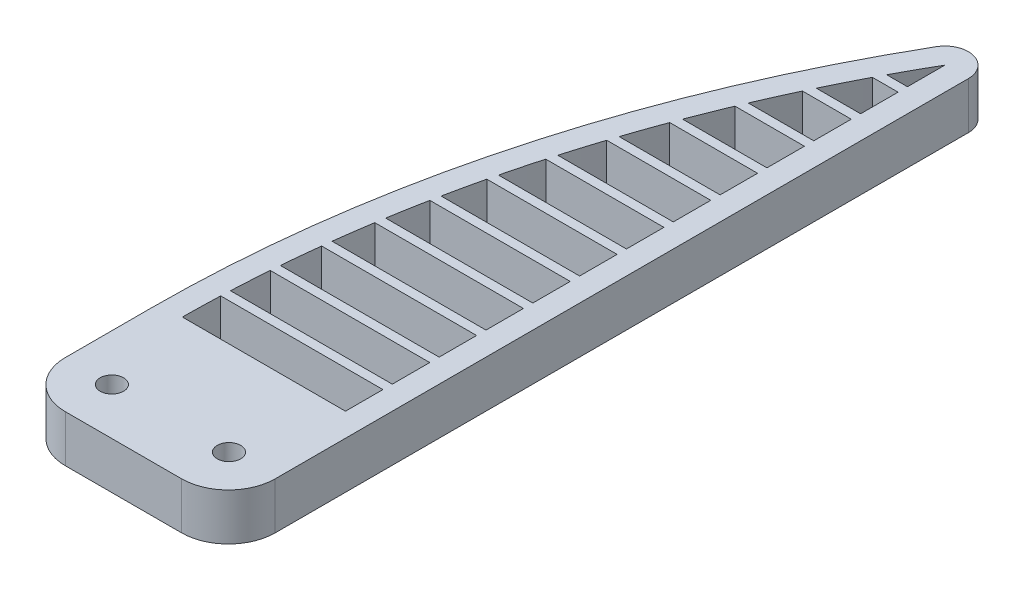
from build123d import *

# Parameters (mm, degrees)
SKETCH1_W           = 34.833395016
SKETCH1_H           = 8
SKETCH1_W_2         = 5
SKETCH1_H_2         = 10
BOSS_EXTRUDE1_DEPTH = 10
FILLET1_R           = 10


with BuildPart() as part:
    # Sketch1 → Boss-Extrude1 (new body)
    with BuildSketch(Plane(origin=(0, 0, 0), x_dir=(1, 0, 0), z_dir=(0, 1, 0))):
        with BuildLine():
            Line((-34.833395016, 0), (0, 0))
            Line((0, 0), (0, 2))
            Line((0, 2), (-34.825702595, 2))
            ThreePointArc((-34.825702595, 2), (-34.831471904, 1.000007397), (-34.833395016, 0))
        make_face()
        Polygon((0, 2), (0, 0), (5, 0), (5, 130), (0, 130), (0, 122), (0, 120), (0, 112), (0, 110), (0, 102), (0, 100), (0, 92), (0, 90), (0, 82), (0, 80), (0, 72), (0, 70), (0, 62), (0, 60), (0, 52), (0, 50), (0, 42), (0, 40), (0, 32), (0, 30), (0, 22), (0, 20), (0, 12), (0, 10), align=None)
        with BuildLine():
            Line((-34.641016151, 10), (0, 10))
            Line((0, 10), (0, 12))
            Line((0, 12), (-34.556324308, 12))
            ThreePointArc((-34.556324308, 12), (-34.600595037, 11.000081508), (-34.641016151, 10))
        make_face()
        with BuildLine():
            Line((-39.833395016, 0), (-34.833395016, 0))
            ThreePointArc((-34.833395016, 0), (-34.831471904, 1.000007397), (-34.825702595, 2))
            ThreePointArc((-34.825702595, 2), (-34.764138624, 6.000710564), (-34.641016151, 10))
            ThreePointArc((-34.641016151, 10), (-34.600595037, 11.000081508), (-34.556324308, 12))
            ThreePointArc((-34.556324308, 12), (-34.340503133, 16.001901029), (-34.063022952, 20))
            ThreePointArc((-34.063022952, 20), (-33.98391775, 21.000156347), (-33.900953772, 22))
            ThreePointArc((-33.900953772, 22), (-33.529816222, 26.003108568), (-33.096826419, 30))
            ThreePointArc((-33.096826419, 30), (-32.978675002, 31.000232599), (-32.856649782, 32))
            ThreePointArc((-32.856649782, 32), (-32.328418622, 36.004344436), (-31.738046589, 40))
            ThreePointArc((-31.738046589, 40), (-31.580302492, 41.000310991), (-31.418663494, 42))
            ThreePointArc((-31.418663494, 42), (-30.730801915, 46.005620768), (-29.98041146, 50))
            ThreePointArc((-29.98041146, 50), (-29.782331047, 51.000392318), (-29.580328265, 52))
            ThreePointArc((-29.580328265, 52), (-28.729478957, 56.006950993), (-27.81560783, 60))
            ThreePointArc((-27.81560783, 60), (-27.576232201, 61.000477471), (-27.332899966, 62))
            ThreePointArc((-27.332899966, 62), (-26.314801256, 66.008350348), (-25.233075527, 70))
            ThreePointArc((-25.233075527, 70), (-24.951206094, 71.000567472), (-24.66533853, 72))
            ThreePointArc((-24.66533853, 72), (-23.474712485, 76.009836516), (-22.219732553, 80))
            ThreePointArc((-22.219732553, 80), (-21.893898758, 81.00066352), (-21.564017355, 82))
            ThreePointArc((-21.564017355, 82), (-20.194422544, 86.011430464), (-18.759613369, 90))
            ThreePointArc((-18.759613369, 90), (-18.388030357, 91.000767051), (-18.012341473, 92))
            ThreePointArc((-18.012341473, 92), (-16.455980001, 96.013157563), (-14.833395016, 100))
            ThreePointArc((-14.833395016, 100), (-14.413908154, 101.00087982), (-13.990247312, 102))
            ThreePointArc((-13.990247312, 102), (-12.237711236, 106.01504912), (-10.417774804, 110))
            ThreePointArc((-10.417774804, 110), (-9.947786552, 111.001004016), (-9.473545033, 112))
            ThreePointArc((-9.473545033, 112), (-7.513480483, 116.017144539), (-5.484646909, 120))
            ThreePointArc((-5.484646909, 120), (-4.961019464, 121.001142415), (-4.433046584, 122))
            ThreePointArc((-4.433046584, 122), (-2.25170348, 126.019494426), (0, 130))
            Line((0, 130), (-1.200062972, 134.853848871))
            ThreePointArc((-1.200062972, 134.853848871), (-3.00514583, 133.996135451), (-4.330127019, 132.5))
            ThreePointArc((-4.330127019, 132.5), (-30.803738983, 68.587046952), (-39.833395016, 0))
        make_face()
        with BuildLine():
            Line((-34.063022952, 20), (0, 20))
            Line((0, 20), (0, 22))
            Line((0, 22), (-33.900953772, 22))
            ThreePointArc((-33.900953772, 22), (-33.98391775, 21.000156347), (-34.063022952, 20))
        make_face()
        with BuildLine():
            Line((-33.096826419, 30), (0, 30))
            Line((0, 30), (0, 32))
            Line((0, 32), (-32.856649782, 32))
            ThreePointArc((-32.856649782, 32), (-32.978675002, 31.000232599), (-33.096826419, 30))
        make_face()
        with BuildLine():
            Line((-31.738046589, 40), (0, 40))
            Line((0, 40), (0, 42))
            Line((0, 42), (-31.418663494, 42))
            ThreePointArc((-31.418663494, 42), (-31.580302492, 41.000310991), (-31.738046589, 40))
        make_face()
        with BuildLine():
            Line((-29.98041146, 50), (0, 50))
            Line((0, 50), (0, 52))
            Line((0, 52), (-29.580328265, 52))
            ThreePointArc((-29.580328265, 52), (-29.782331047, 51.000392318), (-29.98041146, 50))
        make_face()
        with BuildLine():
            Line((-1.200062972, 134.853848871), (0, 130))
            Line((0, 130), (2.583616786, 134.280762117))
            ThreePointArc((2.583616786, 134.280762117), (0.748773929, 134.943615843), (-1.200062972, 134.853848871))
        make_face()
        with BuildLine():
            Line((0, 130), (5, 130))
            ThreePointArc((5, 130), (4.3541982, 132.457836047), (2.583616786, 134.280762117))
            Line((2.583616786, 134.280762117), (0, 130))
        make_face()
        with BuildLine():
            Line((0, 120), (0, 122))
            Line((0, 122), (-4.433046584, 122))
            ThreePointArc((-4.433046584, 122), (-4.961019464, 121.001142415), (-5.484646909, 120))
            Line((-5.484646909, 120), (0, 120))
        make_face()
        with BuildLine():
            Line((0, 110), (0, 112))
            Line((0, 112), (-9.473545033, 112))
            ThreePointArc((-9.473545033, 112), (-9.947786552, 111.001004016), (-10.417774804, 110))
            Line((-10.417774804, 110), (0, 110))
        make_face()
        with BuildLine():
            Line((0, 100), (0, 102))
            Line((0, 102), (-13.990247312, 102))
            ThreePointArc((-13.990247312, 102), (-14.413908154, 101.00087982), (-14.833395016, 100))
            Line((-14.833395016, 100), (0, 100))
        make_face()
        with BuildLine():
            Line((0, 90), (0, 92))
            Line((0, 92), (-18.012341473, 92))
            ThreePointArc((-18.012341473, 92), (-18.388030357, 91.000767051), (-18.759613369, 90))
            Line((-18.759613369, 90), (0, 90))
        make_face()
        with BuildLine():
            Line((0, 80), (0, 82))
            Line((0, 82), (-21.564017355, 82))
            ThreePointArc((-21.564017355, 82), (-21.893898758, 81.00066352), (-22.219732553, 80))
            Line((-22.219732553, 80), (0, 80))
        make_face()
        with BuildLine():
            Line((-25.233075527, 70), (0, 70))
            Line((0, 70), (0, 72))
            Line((0, 72), (-24.66533853, 72))
            ThreePointArc((-24.66533853, 72), (-24.951206094, 71.000567472), (-25.233075527, 70))
        make_face()
        with BuildLine():
            Line((-27.81560783, 60), (0, 60))
            Line((0, 60), (0, 62))
            Line((0, 62), (-27.332899966, 62))
            ThreePointArc((-27.332899966, 62), (-27.576232201, 61.000477471), (-27.81560783, 60))
        make_face()
        with Locations((-17.416697508, -4)):
            Rectangle(SKETCH1_W, SKETCH1_H)
        Polygon((-34.833395016, -8), (-34.833395016, 0), (-39.833395016, 0), (-39.833395016, -18), (-34.833395016, -18), align=None)
        with Locations((-37.333395016, -23)):
            Rectangle(SKETCH1_W_2, SKETCH1_H_2)
        with BuildLine():
            Line((0, -28), (0, -18))
            Line((0, -18), (-2.375046262, -18))
            ThreePointArc((-2.375046262, -18), (-4.875046262, -20.5), (-7.375046262, -18))
            Line((-7.375046262, -18), (-19.916697508, -18))
            Line((-19.916697508, -18), (-27.375046262, -18))
            ThreePointArc((-27.375046262, -18), (-29.875046262, -20.5), (-32.375046262, -18))
            Line((-32.375046262, -18), (-34.833395016, -18))
            Line((-34.833395016, -18), (-34.833395016, -28))
            Line((-34.833395016, -28), (0, -28))
        make_face()
        with BuildLine():
            Line((0, -18), (0, -8))
            Line((0, -8), (-34.833395016, -8))
            Line((-34.833395016, -8), (-34.833395016, -18))
            Line((-34.833395016, -18), (-32.375046262, -18))
            ThreePointArc((-32.375046262, -18), (-31.642813215, -16.232233047), (-29.875046262, -15.5))
            Line((-29.875046262, -15.5), (-4.875046262, -15.5))
            ThreePointArc((-4.875046262, -15.5), (-3.107279309, -16.232233047), (-2.375046262, -18))
            Line((-2.375046262, -18), (0, -18))
        make_face()
        with BuildLine():
            Line((-19.916697508, -18), (-7.375046262, -18))
            ThreePointArc((-7.375046262, -18), (-6.642813215, -16.232233047), (-4.875046262, -15.5))
            Line((-4.875046262, -15.5), (-29.875046262, -15.5))
            ThreePointArc((-29.875046262, -15.5), (-28.107279309, -16.232233047), (-27.375046262, -18))
            Line((-27.375046262, -18), (-19.916697508, -18))
        make_face()
        Polygon((5, 0), (0, 0), (0, -8), (0, -18), (0, -28), (5, -28), align=None)
    extrude(amount=BOSS_EXTRUDE1_DEPTH)

    # Fillet1
    fillet1_edges = [part.edges().sort_by_distance(p)[0] for p in [
        (5, 5, 28),
        (-39.833395016, 5, 28),
    ]]
    fillet(fillet1_edges, radius=FILLET1_R)


solid = part.part
